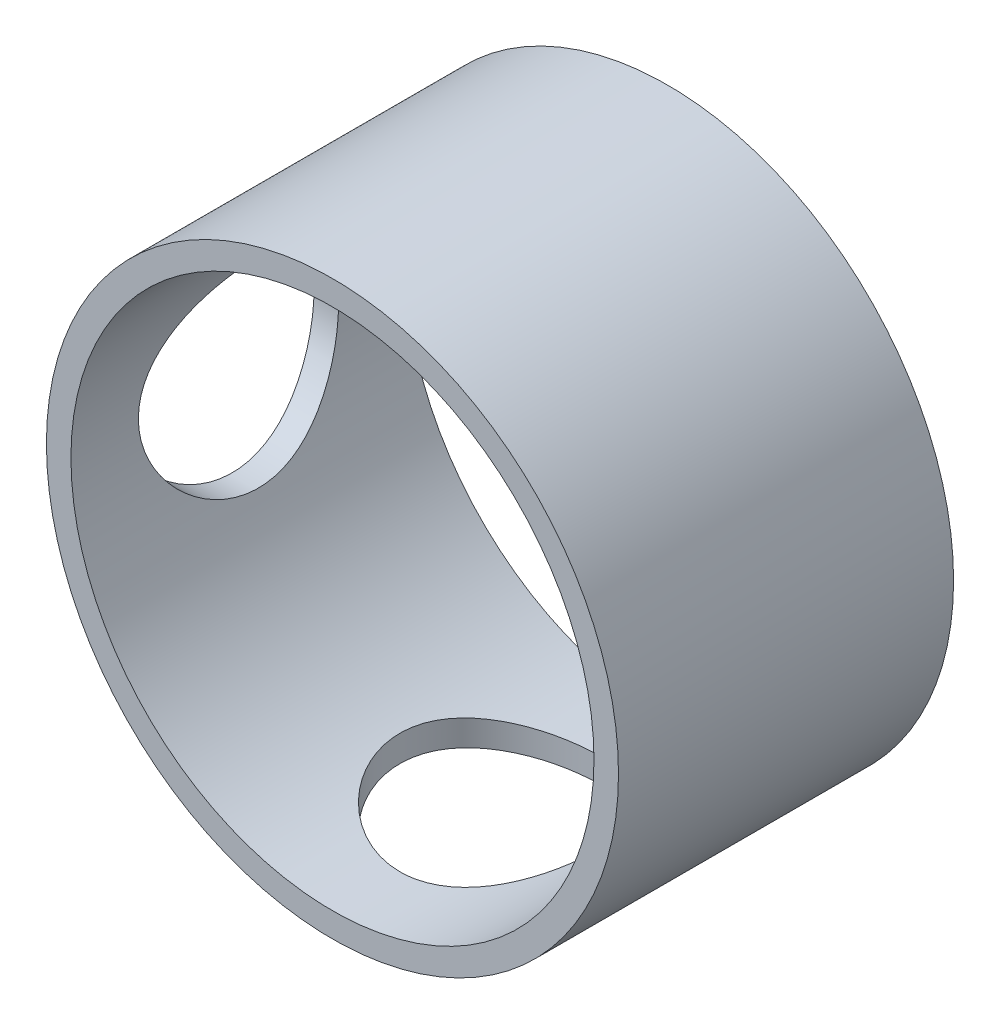
from build123d import *

# Parameters (mm, degrees)
BOSS_EXTRUDE1_DEPTH      = 20.5
BOSS_EXTRUDE1_DEPTH_BACK = 20.5
SKETCH1_R                = 35
SKETCH1_R_2              = 32
SKETCH5_R                = 12.25
CUT_EXTRUDE2_DEPTH       = 54.574714185
SKETCH6_R                = 12.25
CUT_EXTRUDE3_DEPTH       = 54.574714354


with BuildPart() as part:
    # Sketch1 → Boss-Extrude1 (new, two sides: drawn at the far end of the back side and taken through both)
    with BuildSketch(Plane.XY.offset(-BOSS_EXTRUDE1_DEPTH_BACK)):
        Circle(SKETCH1_R)
        Circle(SKETCH1_R_2, mode=Mode.SUBTRACT)
    extrude(amount=BOSS_EXTRUDE1_DEPTH + BOSS_EXTRUDE1_DEPTH_BACK)

    # Sketch5 → Cut-Extrude2 (cut, through all)
    with BuildSketch(Plane(origin=(0, 0, 0), x_dir=(0, 0, -1), z_dir=(1, 0, 0))):
        Circle(SKETCH5_R)
    extrude(amount=-CUT_EXTRUDE2_DEPTH, mode=Mode.SUBTRACT)

    # Sketch6 → Cut-Extrude3 (cut, through all)
    with BuildSketch(Plane(origin=(0, 0, 0), x_dir=(1, 0, 0), z_dir=(0, 1, 0))):
        Circle(SKETCH6_R)
    extrude(amount=-CUT_EXTRUDE3_DEPTH, mode=Mode.SUBTRACT)


solid = part.part
